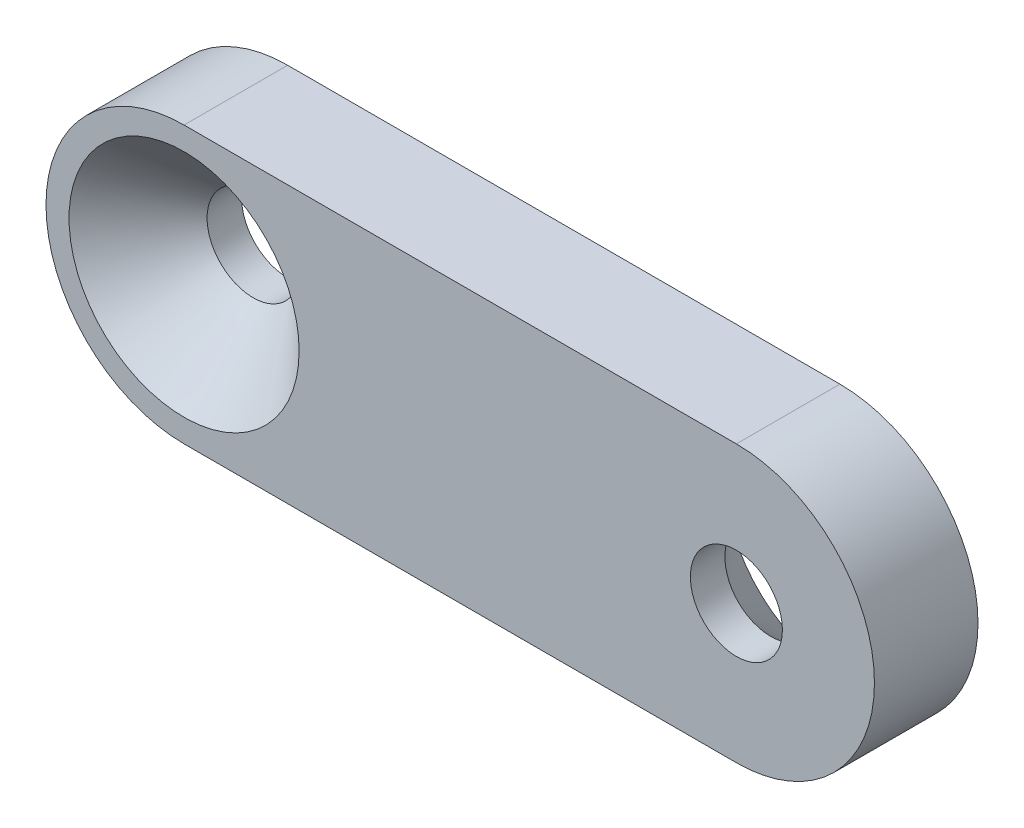
from build123d import *

# Parameters (mm, degrees)
SKETCH1_R           = 2
BOSS_EXTRUDE1_DEPTH = 4.5
CHAMFER1_SIZE       = 3
CHAMFER2_SIZE       = 3


with BuildPart() as part:
    # Sketch1 → Boss-Extrude1 (new body)
    with BuildSketch(Plane.XY):
        with BuildLine():
            Line((-12, 6), (12, 6))
            ThreePointArc((12, 6), (18, 0), (12, -6))
            Line((12, -6), (-12, -6))
            ThreePointArc((-12, -6), (-18, 0), (-12, 6))
        make_face()
        with Locations((-12, 0)):
            Circle(SKETCH1_R, mode=Mode.SUBTRACT)
        with Locations((12, 0)):
            Circle(SKETCH1_R, mode=Mode.SUBTRACT)
    extrude(amount=BOSS_EXTRUDE1_DEPTH)

    # Chamfer1
    chamfer1_edges = [part.edges().sort_by_distance(p)[0] for p in [
        (10, 0, 0),
    ]]
    chamfer(chamfer1_edges, length=CHAMFER1_SIZE)

    # Chamfer2
    chamfer2_edges = [part.edges().sort_by_distance(p)[0] for p in [
        (-14, 0, 4.5),
    ]]
    chamfer(chamfer2_edges, length=CHAMFER2_SIZE)


solid = part.part
